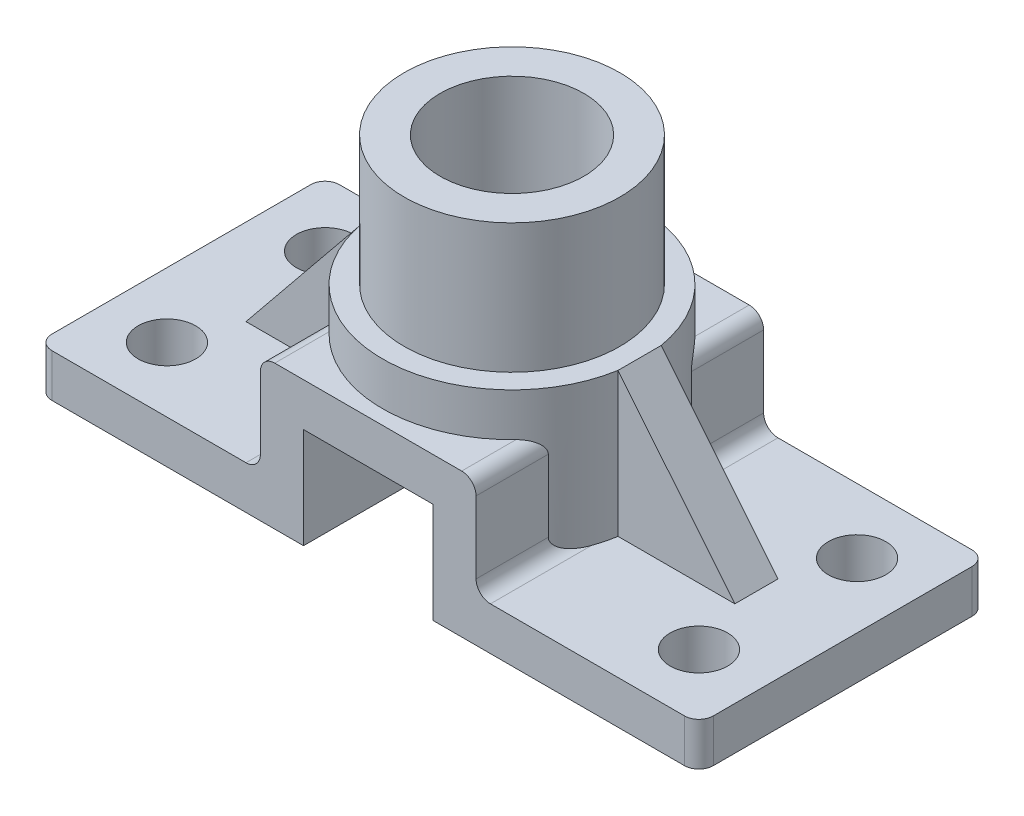
from build123d import *

# Parameters (mm, degrees)
Y_KSEKLIK_EKSTR_ZYON1_DEPTH = 40
RADYUS1_R                   = 2
RADYUS2_R                   = 2
RADYUS4_R                   = 2
RADYUS5_R                   = 2
IZIM5_R                     = 4
KES_EKSTR_ZYON1_DEPTH       = 65.653926759
Y_KSEKLIK_EKSTR_ZYON3_REACH = 70.265
IZIM7_R                     = 18
IZIM8_R                     = 15
IZIM8_R_2                   = 10
Y_KSEKLIK_EKSTR_ZYON4_DEPTH = 18
IZIM9_R                     = 7.5
KES_EKSTR_ZYON3_DEPTH       = 69.265146695
IZIM12_W                    = 6
IZIM12_H                    = 20
Y_KSEKLIK_EKSTR_ZYON5_DEPTH = 19
IZIM13_W                    = 6
IZIM13_H                    = 20
Y_KSEKLIK_EKSTR_ZYON6_DEPTH = 19
KES_EKSTR_ZYON4_DEPTH       = 89.876489715


with BuildPart() as part:
    # Çizim1 → Yükseklik-Ekstrüzyon1 (new body)
    with BuildSketch(Plane.XY):
        Polygon((-43.172443791, 26.610906907), (-6.172443791, 26.610906907), (-6.172443791, 40.610906907), (11.827556209, 40.610906907), (11.827556209, 26.610906907), (48.827556209, 26.610906907), (48.827556209, 32.610906907), (17.827556209, 32.610906907), (17.827556209, 46.610906907), (-12.172443791, 46.610906907), (-12.172443791, 32.610906907), (-43.172443791, 32.610906907), align=None)
    extrude(amount=Y_KSEKLIK_EKSTR_ZYON1_DEPTH)

    # Radyus1
    radyus1_edges = [part.edges().sort_by_distance(p)[0] for p in [
        (-12.172443791, 46.610906907, 20),
        (17.827556209, 46.610906907, 20),
    ]]
    fillet(radyus1_edges, radius=RADYUS1_R)

    # Radyus2
    radyus2_edges = [part.edges().sort_by_distance(p)[0] for p in [
        (-12.172443791, 32.610906907, 20),
        (17.827556209, 32.610906907, 20),
    ]]
    fillet(radyus2_edges, radius=RADYUS2_R)

    # Radyus4
    radyus4_edges = [part.edges().sort_by_distance(p)[0] for p in [
        (-43.172443791, 29.610906907, 0),
        (48.827556209, 29.610906907, 40),
        (-43.172443791, 29.610906907, 40),
    ]]
    fillet(radyus4_edges, radius=RADYUS4_R)

    # Radyus5
    radyus5_edges = [part.edges().sort_by_distance(p)[0] for p in [
        (48.827556209, 29.610906907, 0),
    ]]
    fillet(radyus5_edges, radius=RADYUS5_R)

    # Çizim5 → Kes-Ekstrüzyon1 (cut, through all)
    with BuildSketch(Plane(origin=(0, 32.610906907, 0), x_dir=(1, 0, 0), z_dir=(0, 1, 0))):
        with Locations(Location((-34.172443791, -9, 0), (0, 0, 180))):
            Circle(IZIM5_R)
        with Locations(Location((-34.172443791, -31, 0), (0, 0, 180))):
            Circle(IZIM5_R)
        with Locations(Location((39.827556209, -9, 0), (0, 0, 180))):
            Circle(IZIM5_R)
        with Locations(Location((39.827556209, -31, 0), (0, 0, 180))):
            Circle(IZIM5_R)
    extrude(amount=-KES_EKSTR_ZYON1_DEPTH, mode=Mode.SUBTRACT)

    # Çizim7 → Yükseklik-Ekstrüzyon3 (add, up to next)
    with BuildSketch(Plane(origin=(0, 52.610906907, 0), x_dir=(1, 0, 0), z_dir=(0, 1, 0)), mode=Mode.PRIVATE) as y_kseklik_ekstr_zyon3_sk1:
        with Locations(Location((2.827556209, -20, 0), (0, 0, 180))):
            Circle(IZIM7_R)
    y_kseklik_ekstr_zyon3_tool1 = extrude(y_kseklik_ekstr_zyon3_sk1.sketch, amount=-Y_KSEKLIK_EKSTR_ZYON3_REACH, mode=Mode.PRIVATE) - part.part
    add(y_kseklik_ekstr_zyon3_tool1.solids().sort_by_distance((2.827556, 52.610907, 20))[0])

    # Çizim8 → Yükseklik-Ekstrüzyon4 (add)
    with BuildSketch(Plane(origin=(0, 52.610906907, 0), x_dir=(1, 0, 0), z_dir=(0, 1, 0))):
        with Locations(Location((2.827556209, -20, 0), (0, 0, 180))):
            Circle(IZIM8_R)
        with Locations(Location((2.827556209, -20, 0), (0, 0, 180))):
            Circle(IZIM8_R_2, mode=Mode.SUBTRACT)
    extrude(amount=Y_KSEKLIK_EKSTR_ZYON4_DEPTH)

    # Çizim9 → Kes-Ekstrüzyon3 (cut, through all)
    with BuildSketch(Plane(origin=(0, 52.610906907, 0), x_dir=(1, 0, 0), z_dir=(0, 1, 0))):
        with Locations(Location((2.827556209, -20, 0), (0, 0, 180))):
            Circle(IZIM9_R)
    extrude(amount=-KES_EKSTR_ZYON3_DEPTH, mode=Mode.SUBTRACT)

    # Çizim12 → Yükseklik-Ekstrüzyon5 (add)
    with BuildSketch(Plane.ZY.offset(12.172443791)):
        with Locations((20, 42.610906907)):
            Rectangle(IZIM12_W, IZIM12_H)
    extrude(amount=Y_KSEKLIK_EKSTR_ZYON5_DEPTH)

    # Çizim13 → Yükseklik-Ekstrüzyon6 (add)
    with BuildSketch(Plane(origin=(17.827556209, 0, 0), x_dir=(0, 0, -1), z_dir=(1, 0, 0))):
        with Locations((-20, 42.610906907)):
            Rectangle(IZIM13_W, IZIM13_H)
    extrude(amount=Y_KSEKLIK_EKSTR_ZYON6_DEPTH)

    # Çizim14 → Kes-Ekstrüzyon4 (cut, through all)
    with BuildSketch(Plane.XY.offset(23)):
        Polygon((-14.920683141, 52.610906907), (-31.172443791, 32.610906907), (-51.091158716, 48.796616278), (-34.839398065, 68.796616278), align=None)
        Polygon((20.575795558, 52.610906907), (36.827556209, 32.610906907), (59.044395874, 50.664044939), (42.792635223, 70.664044939), align=None)
    extrude(amount=-KES_EKSTR_ZYON4_DEPTH, mode=Mode.SUBTRACT)


solid = part.part
